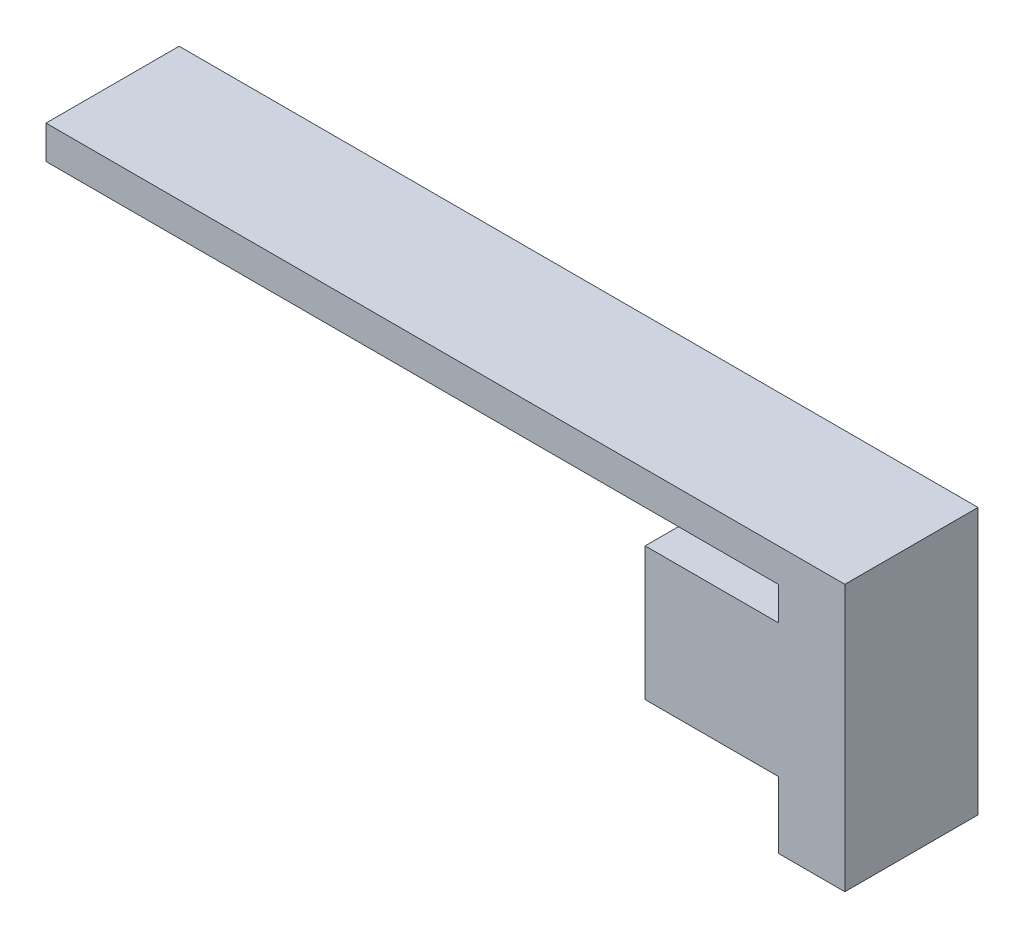
from build123d import *

# Parameters (mm, degrees)
SKETCH_1_W      = 60
SKETCH_1_H      = 10
EXTRUDE_1_DEPTH = 2.5
EXTRUDE_START   = 25
SKETCH_2_W      = 10
SKETCH_2_H      = 20
EXTRUDE_2_DEPTH = 5
SKETCH_5_W      = 10
SKETCH_5_H      = 10
EXTRUDE_3_DEPTH = 10


with BuildPart() as part:
    # 草图1 → 凸台-拉伸1 (new body)
    with BuildSketch(Plane(origin=(0, 0, 0), x_dir=(1, 0, 0), z_dir=(0, 1, 0))):
        Rectangle(SKETCH_1_W, SKETCH_1_H)
    extrude(amount=EXTRUDE_1_DEPTH)

    # 草图2 → 凸台-拉伸2 (add)
    with BuildSketch(Plane(origin=(0, 0, 0), x_dir=(0, 0, -1), z_dir=(1, 0, 0)).offset(EXTRUDE_START)):
        with Locations((0, -7.5)):
            Rectangle(SKETCH_2_W, SKETCH_2_H)
    extrude(amount=EXTRUDE_2_DEPTH)

    # 草图5 → 凸台-拉伸3 (add)
    with BuildSketch(Plane.ZY.offset(-25)):
        with Locations((0, -7.5)):
            Rectangle(SKETCH_5_W, SKETCH_5_H)
    extrude(amount=EXTRUDE_3_DEPTH)


solid = part.part
